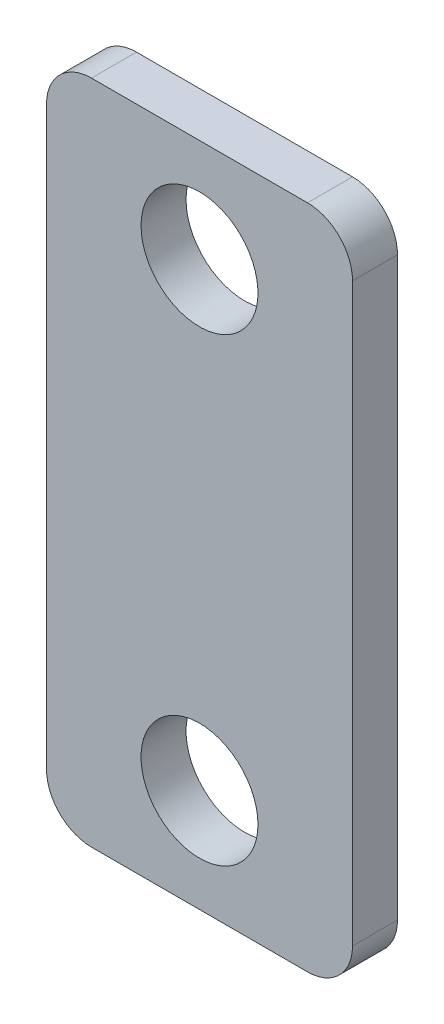
from build123d import *

# Parameters (mm, degrees)
SKETCH1_W           = 21.59
SKETCH1_H           = 46.99
SKETCH1_R           = 4.124999878
BOSS_EXTRUDE1_DEPTH = 3.175
FILLET1_R           = 3.175


with BuildPart() as part:
    # Sketch1 → Boss-Extrude1 (new body)
    with BuildSketch(Plane.XY):
        with Locations((10.795, 23.495)):
            Rectangle(SKETCH1_W, SKETCH1_H)
        with Locations((10.795, 7.260198401)):
            Circle(SKETCH1_R, mode=Mode.SUBTRACT)
        with Locations(Location((10.795, 39.729801599, 0), (0, 0, 180))):
            Circle(SKETCH1_R, mode=Mode.SUBTRACT)
    extrude(amount=BOSS_EXTRUDE1_DEPTH)

    # Fillet1
    fillet1_edges = [part.edges().sort_by_distance(p)[0] for p in [
        (0, 0, 1.5875),
        (21.59, 0, 1.5875),
        (21.59, 46.99, 1.5875),
        (0, 46.99, 1.5875),
    ]]
    fillet(fillet1_edges, radius=FILLET1_R)


solid = part.part
